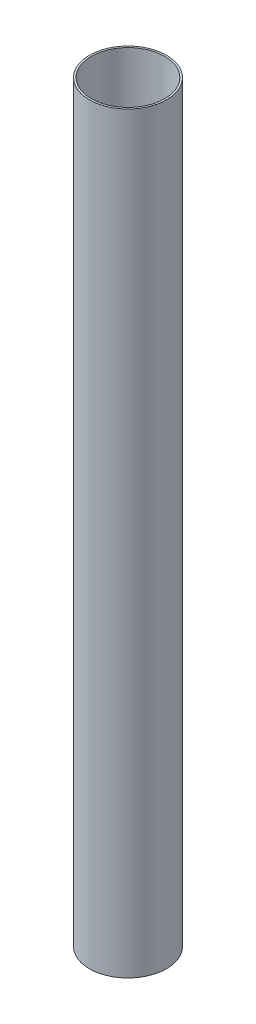
from build123d import *

# Parameters (mm, degrees)
SKETCH1_R   = 25.4
SKETCH1_R_2 = 24.1554
BODY_DEPTH  = 495.3


with BuildPart() as part:
    # Sketch1 → body (new body)
    with BuildSketch(Plane(origin=(0, 0, 0), x_dir=(1, 0, 0), z_dir=(0, 1, 0))):
        with Locations(Location((0, 0, 0), (0, 0, 270))):
            Circle(SKETCH1_R)
        with Locations(Location((0, 0, 0), (0, 0, 270))):
            Circle(SKETCH1_R_2, mode=Mode.SUBTRACT)
    extrude(amount=BODY_DEPTH)


solid = part.part
